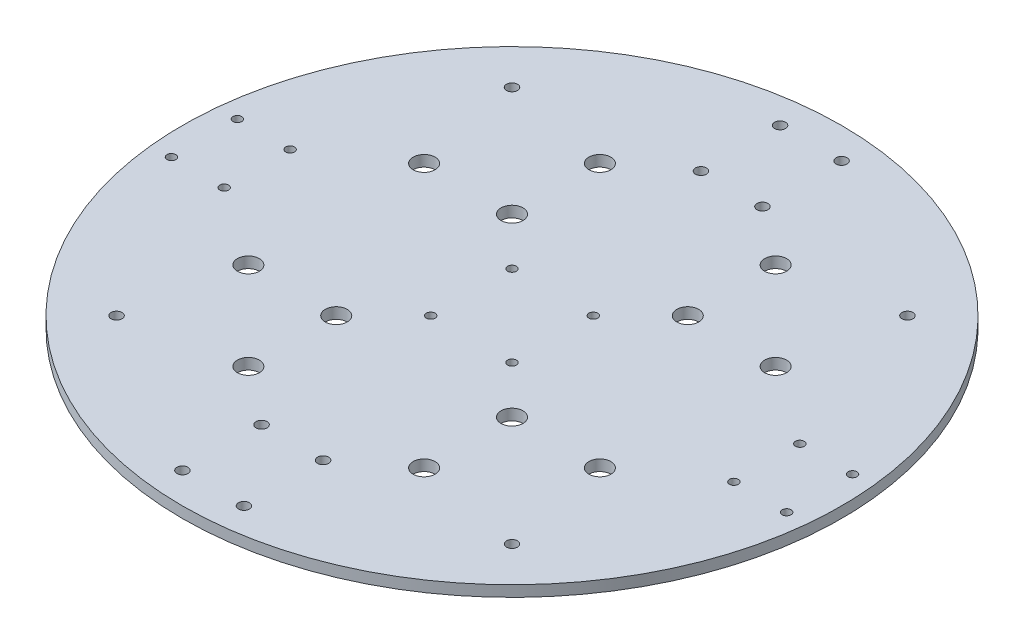
from build123d import *

# Parameters (mm, degrees)
SKETCH_3_R      = 150
SKETCH_3_R_2    = 2
SKETCH_3_R_3    = 2.5
SKETCH_3_R_4    = 5
EXTRUDE_2_DEPTH = 5


with BuildPart() as part:
    # 草图3 → 凸台-拉伸2 (new body)
    with BuildSketch(Plane(origin=(0, 0, 0), x_dir=(1, 0, 0), z_dir=(0, 1, 0))):
        with Locations(Location((0, 0, 0), (0, 0, 270))):
            Circle(SKETCH_3_R)
        with Locations(Location((116, 15, 0), (0, 0, 270))):
            Circle(SKETCH_3_R_2, mode=Mode.SUBTRACT)
        with Locations(Location((140, 15, 0), (0, 0, 270))):
            Circle(SKETCH_3_R_2, mode=Mode.SUBTRACT)
        with Locations(Location((116, -15, 0), (0, 0, 270))):
            Circle(SKETCH_3_R_2, mode=Mode.SUBTRACT)
        with Locations(Location((140, -15, 0), (0, 0, 270))):
            Circle(SKETCH_3_R_2, mode=Mode.SUBTRACT)
        with Locations(Location((-140, -15, 0), (0, 0, 270))):
            Circle(SKETCH_3_R_2, mode=Mode.SUBTRACT)
        with Locations(Location((-140, 15, 0), (0, 0, 270))):
            Circle(SKETCH_3_R_2, mode=Mode.SUBTRACT)
        with Locations(Location((-116, 15, 0), (0, 0, 270))):
            Circle(SKETCH_3_R_2, mode=Mode.SUBTRACT)
        with Locations(Location((-116, -15, 0), (0, 0, 270))):
            Circle(SKETCH_3_R_2, mode=Mode.SUBTRACT)
        with Locations(Location((14, 100, 0), (0, 0, 270))):
            Circle(SKETCH_3_R_3, mode=Mode.SUBTRACT)
        with Locations(Location((-14, 100, 0), (0, 0, 270))):
            Circle(SKETCH_3_R_3, mode=Mode.SUBTRACT)
        with Locations(Location((14, 136, 0), (0, 0, 270))):
            Circle(SKETCH_3_R_3, mode=Mode.SUBTRACT)
        with Locations(Location((-14, 136, 0), (0, 0, 270))):
            Circle(SKETCH_3_R_3, mode=Mode.SUBTRACT)
        with Locations(Location((14, -100, 0), (0, 0, 270))):
            Circle(SKETCH_3_R_3, mode=Mode.SUBTRACT)
        with Locations(Location((14, -136, 0), (0, 0, 270))):
            Circle(SKETCH_3_R_3, mode=Mode.SUBTRACT)
        with Locations(Location((-14, -100, 0), (0, 0, 270))):
            Circle(SKETCH_3_R_3, mode=Mode.SUBTRACT)
        with Locations(Location((-14, -136, 0), (0, 0, 270))):
            Circle(SKETCH_3_R_3, mode=Mode.SUBTRACT)
        with Locations(Location((18.5, 18.5, 0), (0, 0, 270))):
            Circle(SKETCH_3_R_2, mode=Mode.SUBTRACT)
        with Locations(Location((-18.5, 18.5, 0), (0, 0, 270))):
            Circle(SKETCH_3_R_2, mode=Mode.SUBTRACT)
        with Locations(Location((-18.5, -18.5, 0), (0, 0, 270))):
            Circle(SKETCH_3_R_2, mode=Mode.SUBTRACT)
        with Locations(Location((18.5, -18.5, 0), (0, 0, 270))):
            Circle(SKETCH_3_R_2, mode=Mode.SUBTRACT)
        with Locations(Location((90, -90, 0), (0, 0, 270))):
            Circle(SKETCH_3_R_3, mode=Mode.SUBTRACT)
        with Locations(Location((90, 90, 0), (0, 0, 270))):
            Circle(SKETCH_3_R_3, mode=Mode.SUBTRACT)
        with Locations(Location((-90, 90, 0), (0, 0, 270))):
            Circle(SKETCH_3_R_3, mode=Mode.SUBTRACT)
        with Locations(Location((-90, -90, 0), (0, 0, 270))):
            Circle(SKETCH_3_R_3, mode=Mode.SUBTRACT)
        with Locations(Location((40, 40, 0), (0, 0, 270))):
            Circle(SKETCH_3_R_4, mode=Mode.SUBTRACT)
        with Locations(Location((40, -40, 0), (0, 0, 270))):
            Circle(SKETCH_3_R_4, mode=Mode.SUBTRACT)
        with Locations(Location((-40, 40, 0), (0, 0, 270))):
            Circle(SKETCH_3_R_4, mode=Mode.SUBTRACT)
        with Locations(Location((-40, -40, 0), (0, 0, 270))):
            Circle(SKETCH_3_R_4, mode=Mode.SUBTRACT)
        with Locations(Location((80, 40, 0), (0, 0, 270))):
            Circle(SKETCH_3_R_4, mode=Mode.SUBTRACT)
        with Locations(Location((80, -40, 0), (0, 0, 270))):
            Circle(SKETCH_3_R_4, mode=Mode.SUBTRACT)
        with Locations(Location((40, 80, 0), (0, 0, 270))):
            Circle(SKETCH_3_R_4, mode=Mode.SUBTRACT)
        with Locations(Location((-40, 80, 0), (0, 0, 270))):
            Circle(SKETCH_3_R_4, mode=Mode.SUBTRACT)
        with Locations(Location((-80, 40, 0), (0, 0, 270))):
            Circle(SKETCH_3_R_4, mode=Mode.SUBTRACT)
        with Locations(Location((-80, -40, 0), (0, 0, 270))):
            Circle(SKETCH_3_R_4, mode=Mode.SUBTRACT)
        with Locations(Location((-40, -80, 0), (0, 0, 270))):
            Circle(SKETCH_3_R_4, mode=Mode.SUBTRACT)
        with Locations(Location((40, -80, 0), (0, 0, 270))):
            Circle(SKETCH_3_R_4, mode=Mode.SUBTRACT)
    extrude(amount=EXTRUDE_2_DEPTH)


solid = part.part
